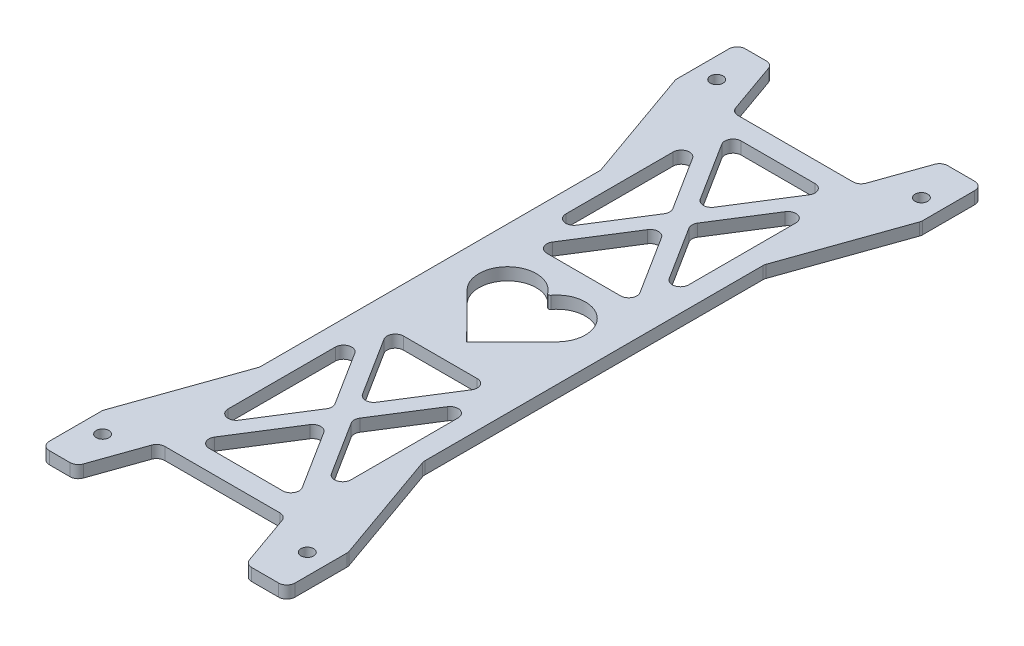
from build123d import *

# Parameters (mm, degrees)
SKETCH_1_R      = 1.55
EXTRUDE_1_DEPTH = 3
FILLET_1_R      = 2
FILLET_2_R      = 0.5


with BuildPart() as part:
    # 草图1 → 凸台-拉伸1 (new body)
    with BuildSketch(Plane(origin=(0, 0, 0), x_dir=(1, 0, 0), z_dir=(0, 1, 0))):
        Polygon((30, -85), (20, -85), (14.705882353, -70), (-16.222232293, -70), (-21.51634994, -85), (-30, -85), (-30, -69.976869686), (-20, -41.643536352), (-20, 41.643536352), (-30, 69.976869686), (-30, 85), (-21.51634994, 85), (-16.222232293, 70), (14.705882353, 70), (20, 85), (30, 85), (30, 69.976869686), (20, 41.643536352), (20, -41.643536352), (30, -69.976869686), align=None)
        with Locations(Location((-25, 75, 0), (0, 0, 270))):
            Circle(SKETCH_1_R, mode=Mode.SUBTRACT)
        with Locations(Location((25, 75, 0), (0, 0, 270))):
            Circle(SKETCH_1_R, mode=Mode.SUBTRACT)
        with Locations(Location((25, -75, 0), (0, 0, 90))):
            Circle(SKETCH_1_R, mode=Mode.SUBTRACT)
        with Locations(Location((-25, -75, 0), (0, 0, 90))):
            Circle(SKETCH_1_R, mode=Mode.SUBTRACT)
        with BuildLine():
            Line((-10.97228498, 0), (0, -11.072893133))
            Line((0, -11.072893133), (10.97228498, 0))
            ThreePointArc((10.97228498, 0), (10.2971634, 10.452899726), (0, 8.532658143))
            ThreePointArc((0, 8.532658143), (-10.2971634, 10.452899726), (-10.97228498, 0))
        make_face(mode=Mode.SUBTRACT)
        Polygon((12.634504731, 65), (0, 44.995367509), (-12.634504731, 65), align=None, mode=Mode.SUBTRACT)
        Polygon((-12.634504731, 17.5), (0, 37.504632491), (12.634504731, 17.5), align=None, mode=Mode.SUBTRACT)
        Polygon((-15, 61.254632491), (-2.365495269, 41.25), (-15, 21.245367509), align=None, mode=Mode.SUBTRACT)
        Polygon((15, 61.254632491), (15, 21.245367509), (2.365495269, 41.25), align=None, mode=Mode.SUBTRACT)
        Polygon((2.365495269, -41.25), (15, -61.254632491), (15, -21.245367509), align=None, mode=Mode.SUBTRACT)
        Polygon((-12.634504731, -65), (12.634504731, -65), (0, -44.995367509), align=None, mode=Mode.SUBTRACT)
        Polygon((-15, -21.245367509), (-15, -61.254632491), (-2.365495269, -41.25), align=None, mode=Mode.SUBTRACT)
        Polygon((12.634504731, -17.5), (-12.634504731, -17.5), (0, -37.504632491), align=None, mode=Mode.SUBTRACT)
    extrude(amount=EXTRUDE_1_DEPTH)

    # 圆角1
    fillet_1_edges = [part.edges().sort_by_distance(p)[0] for p in [
        (-15, 1.5, -21.245367509),
        (-2.365495269, 1.5, -41.25),
        (-15, 1.5, -61.254632491),
        (-12.634504731, 1.5, -17.5),
        (12.634504731, 1.5, -17.5),
        (0, 1.5, -37.504632491),
        (0, 1.5, 44.995367509),
        (-12.634504731, 1.5, 65),
        (12.634504731, 1.5, 65),
        (-2.365495269, 1.5, 41.25),
        (-15, 1.5, 21.245367509),
        (-15, 1.5, 61.254632491),
        (0, 1.5, 37.504632491),
        (12.634504731, 1.5, 17.5),
        (-12.634504731, 1.5, 17.5),
        (-21.51634994, 1.5, -85),
        (-16.222232293, 1.5, -70),
        (14.705882353, 1.5, -70),
        (20, 1.5, -85),
        (30, 1.5, -85),
        (30, 1.5, -69.976869686),
        (20, 1.5, -41.643536352),
        (20, 1.5, 41.643536352),
        (30, 1.5, 69.976869686),
        (30, 1.5, 85),
        (20, 1.5, 85),
        (14.705882353, 1.5, 70),
        (-16.222232293, 1.5, 70),
        (-21.51634994, 1.5, 85),
        (-30, 1.5, 85),
        (-30, 1.5, 69.976869686),
        (-20, 1.5, 41.643536352),
        (-20, 1.5, -41.643536352),
        (-30, 1.5, -69.976869686),
        (-30, 1.5, -85),
        (15, 1.5, 21.245367509),
        (2.365495269, 1.5, 41.25),
        (15, 1.5, 61.254632491),
        (15, 1.5, -61.254632491),
        (2.365495269, 1.5, -41.25),
        (15, 1.5, -21.245367509),
        (-12.634504731, 1.5, -65),
        (0, 1.5, -44.995367509),
        (12.634504731, 1.5, -65),
    ]]
    fillet(fillet_1_edges, radius=FILLET_1_R)

    # 圆角2
    fillet_2_edges = [part.edges().sort_by_distance(p)[0] for p in [
        (0, 1.5, -8.532658143),
    ]]
    fillet(fillet_2_edges, radius=FILLET_2_R)


solid = part.part
